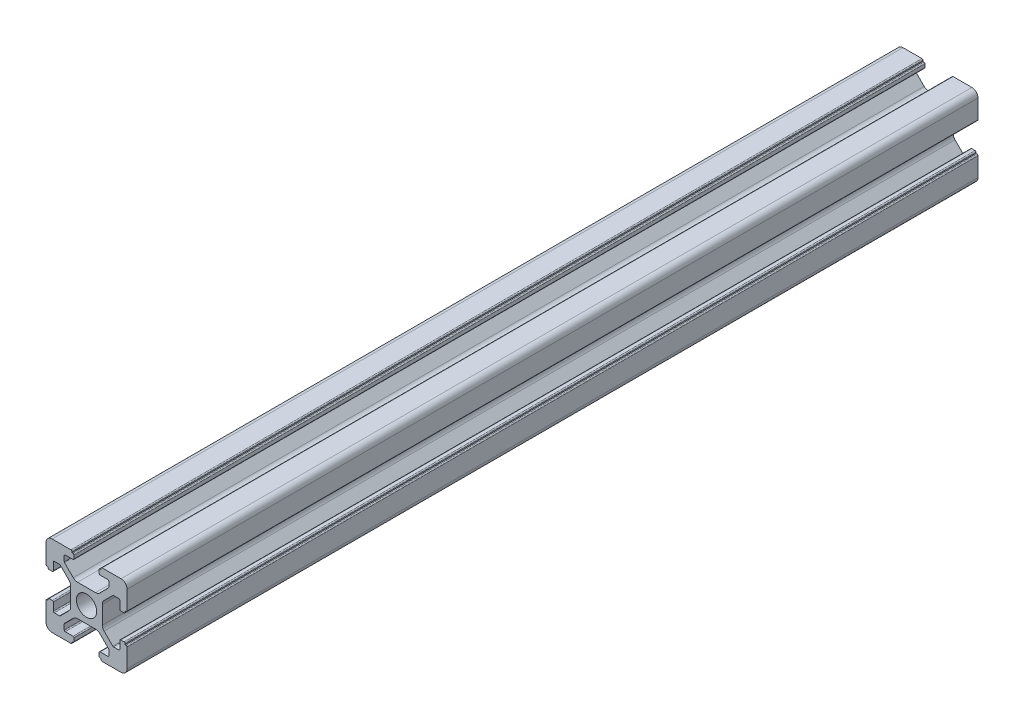
from build123d import *

# Parameters (mm, degrees)
SKETCH_1_R      = 2.5
EXTRUDE_1_DEPTH = 210


with BuildPart() as part:
    # 草图1 → 凸台-拉伸1 (new body)
    with BuildSketch(Plane.XY):
        with BuildLine():
            Line((-8.502261885, -10.002261885), (-3.85, -10.002261885))
            ThreePointArc((-3.85, -10.002261885), (-3.673223305, -9.929038581), (-3.6, -9.752261885))
            Line((-3.6, -9.752261885), (-3.6, -9.502261885))
            Line((-3.6, -9.502261885), (-3.35, -9.502261885))
            ThreePointArc((-3.35, -9.502261885), (-3.173223305, -9.429038581), (-3.1, -9.252261885))
            Line((-3.1, -9.252261885), (-3.1, -8.45))
            ThreePointArc((-3.1, -8.45), (-3.173223305, -8.273223305), (-3.35, -8.2))
            Line((-3.35, -8.2), (-5.25, -8.2))
            ThreePointArc((-5.25, -8.2), (-5.426776695, -8.126776695), (-5.5, -7.95))
            Line((-5.5, -7.95), (-5.5, -6.664213562))
            ThreePointArc((-5.5, -6.664213562), (-5.480969883, -6.568542704), (-5.426776695, -6.487436867))
            Line((-5.426776695, -6.487436867), (-3.278679656, -4.339339828))
            ThreePointArc((-3.278679656, -4.339339828), (-2.792044633, -4.014180701), (-2.218019485, -3.9))
            Line((-2.218019485, -3.9), (2.218019485, -3.9))
            ThreePointArc((2.218019485, -3.9), (2.792044633, -4.014180701), (3.278679656, -4.339339828))
            Line((3.278679656, -4.339339828), (5.426776695, -6.487436867))
            ThreePointArc((5.426776695, -6.487436867), (5.480969883, -6.568542704), (5.5, -6.664213562))
            Line((5.5, -6.664213562), (5.5, -7.95))
            ThreePointArc((5.5, -7.95), (5.426776695, -8.126776695), (5.25, -8.2))
            Line((5.25, -8.2), (3.35, -8.2))
            ThreePointArc((3.35, -8.2), (3.173223305, -8.273223305), (3.1, -8.45))
            Line((3.1, -8.45), (3.1, -9.252261885))
            ThreePointArc((3.1, -9.252261885), (3.173223305, -9.429038581), (3.35, -9.502261885))
            Line((3.35, -9.502261885), (3.6, -9.502261885))
            Line((3.6, -9.502261885), (3.6, -9.752261885))
            ThreePointArc((3.6, -9.752261885), (3.673223305, -9.929038581), (3.85, -10.002261885))
            Line((3.85, -10.002261885), (8.502261885, -10.002261885))
            ThreePointArc((8.502261885, -10.002261885), (9.562922057, -9.562922057), (10.002261885, -8.502261885))
            Line((10.002261885, -8.502261885), (10.002261885, -3.85))
            ThreePointArc((10.002261885, -3.85), (9.929038581, -3.673223305), (9.752261885, -3.6))
            Line((9.752261885, -3.6), (9.502261885, -3.6))
            Line((9.502261885, -3.6), (9.502261885, -3.35))
            ThreePointArc((9.502261885, -3.35), (9.429038581, -3.173223305), (9.252261885, -3.1))
            Line((9.252261885, -3.1), (8.45, -3.1))
            ThreePointArc((8.45, -3.1), (8.273223305, -3.173223305), (8.2, -3.35))
            Line((8.2, -3.35), (8.2, -5.25))
            ThreePointArc((8.2, -5.25), (8.126776695, -5.426776695), (7.95, -5.5))
            Line((7.95, -5.5), (6.664213562, -5.5))
            ThreePointArc((6.664213562, -5.5), (6.568542704, -5.480969883), (6.487436867, -5.426776695))
            Line((6.487436867, -5.426776695), (4.339339828, -3.278679656))
            ThreePointArc((4.339339828, -3.278679656), (4.014180701, -2.792044633), (3.9, -2.218019485))
            Line((3.9, -2.218019485), (3.9, 2.218019485))
            ThreePointArc((3.9, 2.218019485), (4.014180701, 2.792044633), (4.339339828, 3.278679656))
            Line((4.339339828, 3.278679656), (6.487436867, 5.426776695))
            ThreePointArc((6.487436867, 5.426776695), (6.568542704, 5.480969883), (6.664213562, 5.5))
            Line((6.664213562, 5.5), (7.95, 5.5))
            ThreePointArc((7.95, 5.5), (8.126776695, 5.426776695), (8.2, 5.25))
            Line((8.2, 5.25), (8.2, 3.35))
            ThreePointArc((8.2, 3.35), (8.273223305, 3.173223305), (8.45, 3.1))
            Line((8.45, 3.1), (9.252261885, 3.1))
            ThreePointArc((9.252261885, 3.1), (9.429038581, 3.173223305), (9.502261885, 3.35))
            Line((9.502261885, 3.35), (9.502261885, 3.6))
            Line((9.502261885, 3.6), (9.752261885, 3.6))
            ThreePointArc((9.752261885, 3.6), (9.929038581, 3.673223305), (10.002261885, 3.85))
            Line((10.002261885, 3.85), (10.002261885, 8.502261885))
            ThreePointArc((10.002261885, 8.502261885), (9.562922057, 9.562922057), (8.502261885, 10.002261885))
            Line((8.502261885, 10.002261885), (3.85, 10.002261885))
            ThreePointArc((3.85, 10.002261885), (3.673223305, 9.929038581), (3.6, 9.752261885))
            Line((3.6, 9.752261885), (3.6, 9.502261885))
            Line((3.6, 9.502261885), (3.35, 9.502261885))
            ThreePointArc((3.35, 9.502261885), (3.173223305, 9.429038581), (3.1, 9.252261885))
            Line((3.1, 9.252261885), (3.1, 8.45))
            ThreePointArc((3.1, 8.45), (3.173223305, 8.273223305), (3.35, 8.2))
            Line((3.35, 8.2), (5.25, 8.2))
            ThreePointArc((5.25, 8.2), (5.426776695, 8.126776695), (5.5, 7.95))
            Line((5.5, 7.95), (5.5, 6.664213562))
            ThreePointArc((5.5, 6.664213562), (5.480969883, 6.568542704), (5.426776695, 6.487436867))
            Line((5.426776695, 6.487436867), (3.278679656, 4.339339828))
            ThreePointArc((3.278679656, 4.339339828), (2.792044633, 4.014180701), (2.218019485, 3.9))
            Line((2.218019485, 3.9), (-2.218019485, 3.9))
            ThreePointArc((-2.218019485, 3.9), (-2.792044633, 4.014180701), (-3.278679656, 4.339339828))
            Line((-3.278679656, 4.339339828), (-5.426776695, 6.487436867))
            ThreePointArc((-5.426776695, 6.487436867), (-5.480969883, 6.568542704), (-5.5, 6.664213562))
            Line((-5.5, 6.664213562), (-5.5, 7.95))
            ThreePointArc((-5.5, 7.95), (-5.426776695, 8.126776695), (-5.25, 8.2))
            Line((-5.25, 8.2), (-3.35, 8.2))
            ThreePointArc((-3.35, 8.2), (-3.173223305, 8.273223305), (-3.1, 8.45))
            Line((-3.1, 8.45), (-3.1, 9.252261885))
            ThreePointArc((-3.1, 9.252261885), (-3.173223305, 9.429038581), (-3.35, 9.502261885))
            Line((-3.35, 9.502261885), (-3.6, 9.502261885))
            Line((-3.6, 9.502261885), (-3.6, 9.752261885))
            ThreePointArc((-3.6, 9.752261885), (-3.673223305, 9.929038581), (-3.85, 10.002261885))
            Line((-3.85, 10.002261885), (-8.502261885, 10.002261885))
            ThreePointArc((-8.502261885, 10.002261885), (-9.562922057, 9.562922057), (-10.002261885, 8.502261885))
            Line((-10.002261885, 8.502261885), (-10.002261885, 3.85))
            ThreePointArc((-10.002261885, 3.85), (-9.929038581, 3.673223305), (-9.752261885, 3.6))
            Line((-9.752261885, 3.6), (-9.502261885, 3.6))
            Line((-9.502261885, 3.6), (-9.502261885, 3.35))
            ThreePointArc((-9.502261885, 3.35), (-9.429038581, 3.173223305), (-9.252261885, 3.1))
            Line((-9.252261885, 3.1), (-8.45, 3.1))
            ThreePointArc((-8.45, 3.1), (-8.273223305, 3.173223305), (-8.2, 3.35))
            Line((-8.2, 3.35), (-8.2, 5.25))
            ThreePointArc((-8.2, 5.25), (-8.126776695, 5.426776695), (-7.95, 5.5))
            Line((-7.95, 5.5), (-6.664213562, 5.5))
            ThreePointArc((-6.664213562, 5.5), (-6.568542704, 5.480969883), (-6.487436867, 5.426776695))
            Line((-6.487436867, 5.426776695), (-4.339339828, 3.278679656))
            ThreePointArc((-4.339339828, 3.278679656), (-4.014180701, 2.792044633), (-3.9, 2.218019485))
            Line((-3.9, 2.218019485), (-3.9, -2.218019485))
            ThreePointArc((-3.9, -2.218019485), (-4.014180701, -2.792044633), (-4.339339828, -3.278679656))
            Line((-4.339339828, -3.278679656), (-6.487436867, -5.426776695))
            ThreePointArc((-6.487436867, -5.426776695), (-6.568542704, -5.480969883), (-6.664213562, -5.5))
            Line((-6.664213562, -5.5), (-7.95, -5.5))
            ThreePointArc((-7.95, -5.5), (-8.126776695, -5.426776695), (-8.2, -5.25))
            Line((-8.2, -5.25), (-8.2, -3.35))
            ThreePointArc((-8.2, -3.35), (-8.273223305, -3.173223305), (-8.45, -3.1))
            Line((-8.45, -3.1), (-9.252261885, -3.1))
            ThreePointArc((-9.252261885, -3.1), (-9.429038581, -3.173223305), (-9.502261885, -3.35))
            Line((-9.502261885, -3.35), (-9.502261885, -3.6))
            Line((-9.502261885, -3.6), (-9.752261885, -3.6))
            ThreePointArc((-9.752261885, -3.6), (-9.929038581, -3.673223305), (-10.002261885, -3.85))
            Line((-10.002261885, -3.85), (-10.002261885, -8.502261885))
            ThreePointArc((-10.002261885, -8.502261885), (-9.562922057, -9.562922057), (-8.502261885, -10.002261885))
        make_face()
        Circle(SKETCH_1_R, mode=Mode.SUBTRACT)
    extrude(amount=EXTRUDE_1_DEPTH)


solid = part.part
